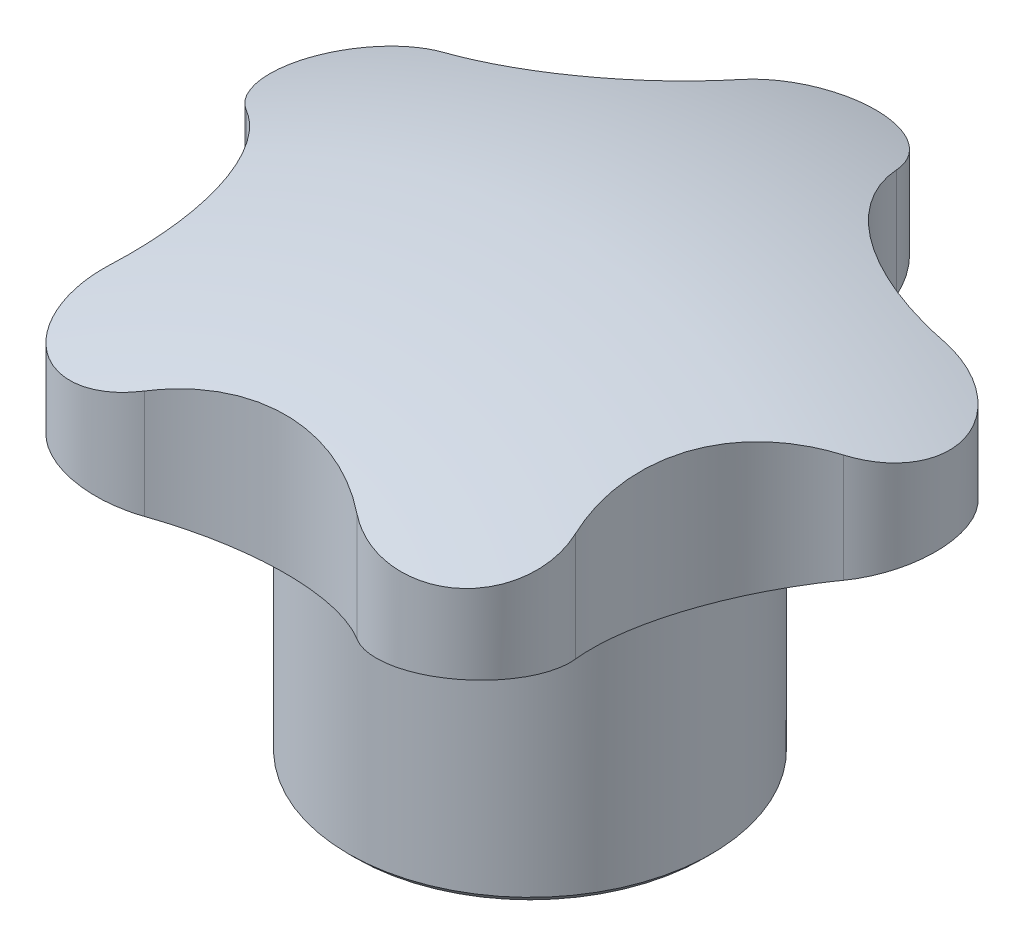
from build123d import *

# Parameters (mm, degrees)
SKETCH_2_R          = 21
CUT_EXTRUDE_1_DEPTH = 39.418745425
SKETCH_3_W          = 3.44
SKETCH_3_H          = 16
CHAMFER_1_SIZE      = 0.42


with BuildPart() as part:
    # 草图1 → 旋转1 (revolve)
    with BuildSketch(Plane.XY, mode=Mode.PRIVATE) as revolve_1_sk:
        with BuildLine():
            Line((0, 0), (-10.5, 0))
            Line((-10.5, 0), (-10.5, 15.6))
            ThreePointArc((-10.5, 15.6), (-15.293686607, 16.575499043), (-20, 17.910281389))
            Line((-20, 17.910281389), (-20, 22.473460386))
            ThreePointArc((-20, 22.473460386), (-10.154266119, 25.111616828), (0, 26))
            Line((0, 26), (0, 0))
        make_face()
    revolve(revolve_1_sk.sketch.rotate(Axis((0, 26, 0), (0, -1, 0)), 270), axis=Axis((0, 26, 0), (0, -1, 0)))

    # 草图2 → 切除-拉伸1 (cut, through all)
    with BuildSketch(Plane(origin=(0, 0, 0), x_dir=(1, 0, 0), z_dir=(0, 1, 0))):
        Circle(SKETCH_2_R)
        with BuildLine():
            ThreePointArc((4.524283339, 16.696844937), (0, 20), (-4.524283339, 16.696844937))
            ThreePointArc((-4.524283339, 16.696844937), (-8.31833689, 11.449208504), (-14.48156274, 9.462457989))
            ThreePointArc((-14.48156274, 9.462457989), (-19.021130326, 6.180339887), (-17.277723618, 0.856759687))
            ThreePointArc((-17.277723618, 0.856759687), (-13.459351819, -4.373208504), (-13.474381322, -10.848724283))
            ThreePointArc((-13.474381322, -10.848724283), (-11.755705046, -16.180339887), (-6.153937105, -16.16733833))
            ThreePointArc((-6.153937105, -16.16733833), (0, -14.152), (6.153937105, -16.16733833))
            ThreePointArc((6.153937105, -16.16733833), (11.755705046, -16.180339887), (13.474381322, -10.848724283))
            ThreePointArc((13.474381322, -10.848724283), (13.459351819, -4.373208504), (17.277723618, 0.856759687))
            ThreePointArc((17.277723618, 0.856759687), (19.021130326, 6.180339887), (14.48156274, 9.462457989))
            ThreePointArc((14.48156274, 9.462457989), (8.31833689, 11.449208504), (4.524283339, 16.696844937))
        make_face(mode=Mode.SUBTRACT)
    extrude(amount=CUT_EXTRUDE_1_DEPTH, mode=Mode.SUBTRACT)

    # 草图3 → 切除-旋转1 (revolve, cut)
    with BuildSketch(Plane.XY, mode=Mode.PRIVATE) as cut_revolve_1_sk:
        with Locations((1.72, 8)):
            Rectangle(SKETCH_3_W, SKETCH_3_H)
    revolve(cut_revolve_1_sk.sketch.rotate(Axis((0, 0, 0), (0, 1, 0)), 90), axis=Axis((0, 0, 0), (0, 1, 0)), mode=Mode.SUBTRACT)

    # 倒角1
    chamfer_1_edges = [part.edges().sort_by_distance(p)[0] for p in [
        (0, 0, -10.5),
    ]]
    chamfer(chamfer_1_edges, length=CHAMFER_1_SIZE)


solid = part.part
